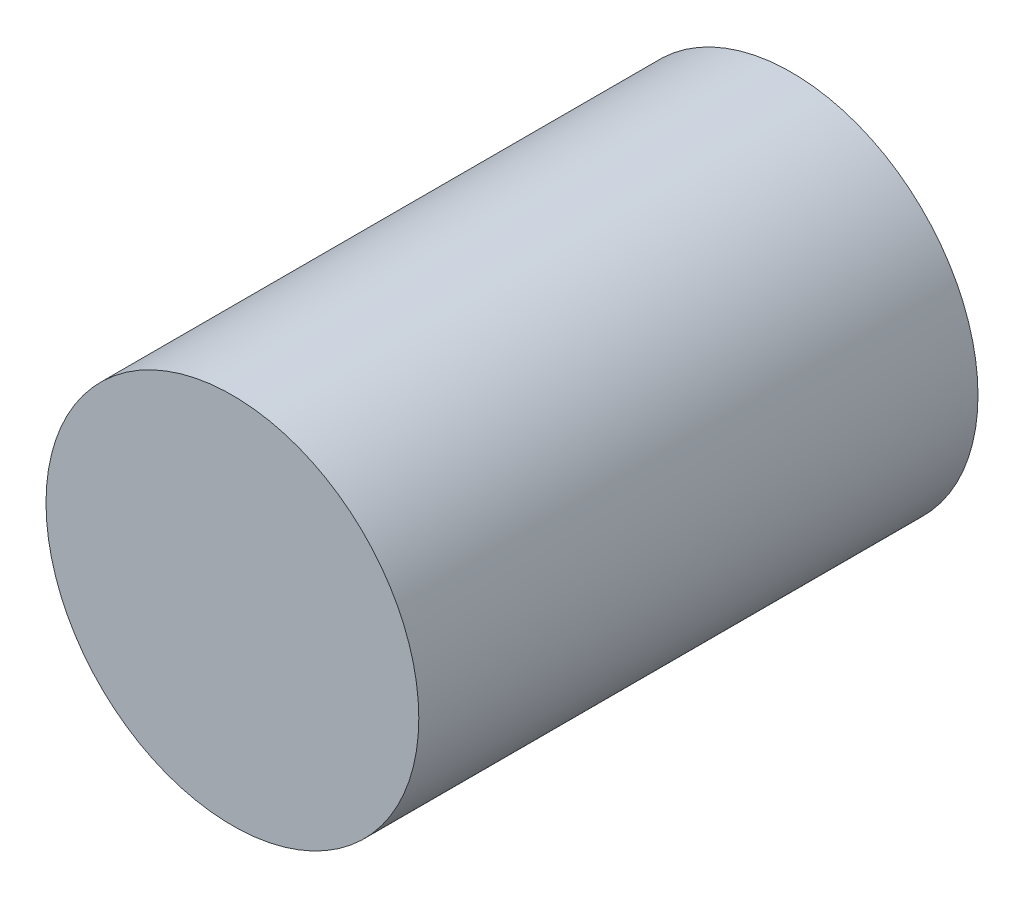
from build123d import *

# Parameters (mm, degrees)
SKETCH1_W = 50
SKETCH1_H = 150


with BuildPart() as part:
    # Sketch1 → Revolve1 (revolve)
    with BuildSketch(Plane(origin=(0, 0, 0), x_dir=(1, 0, 0), z_dir=(0, 1, 0)), mode=Mode.PRIVATE) as revolve1_sk:
        with Locations((-25, 25)):
            Rectangle(SKETCH1_W, SKETCH1_H)
    revolve(revolve1_sk.sketch.rotate(Axis((0, 0, 55), (0, 0, -1)), 180), axis=Axis((0, 0, 55), (0, 0, -1)))


solid = part.part
